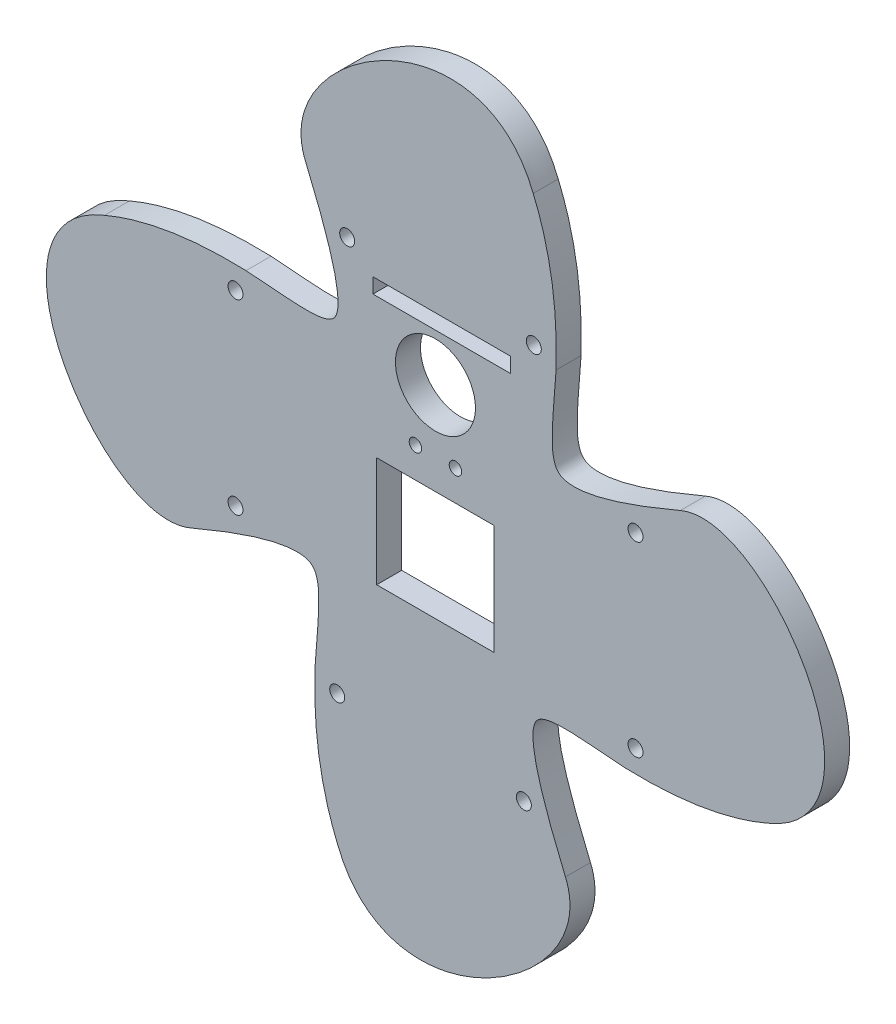
from build123d import *

# Parameters (mm, degrees)
SKETCH1_R           = 8
SKETCH1_R_2         = 1.25
SKETCH1_W           = 27.5
SKETCH1_H           = 3
SKETCH1_W_2         = 23.5
SKETCH1_H_2         = 22
BOSS_EXTRUDE1_DEPTH = 5
CUT_EXTRUDE1_REACH  = 168.202
SKETCH2_R           = 1.5


with BuildPart() as part:
    # Sketch1 → Boss-Extrude1 (new body)
    with BuildSketch(Plane.XY):
        with BuildLine():
            add(Edge.make_bspline(
                [(-3.541993631, -6.941220914), (-8.666968693, 5.104457964), (-8.115333257, 21.36652323)],
                knots=[0.001185094, 0.001185094, 0.001185094, 1.00088873, 1.00088873, 1.00088873], degree=2))
            add(Edge.make_bspline(
                [(-8.115333257, 21.36652323), (-8.080810315, 21.934786101), (-8.004120201, 23.085051659), (-7.838367146, 25.270998375), (-7.623235007, 27.854676625), (-7.414209946, 30.663838605), (-7.27340889, 33.980921817), (-7.462615956, 36.562976188), (-8.030022014, 38.161534692), (-8.552643779, 38.88333972), (-9.230781404, 39.372633244), (-10.414588865, 39.743554777), (-12.295748423, 39.832283225), (-14.89121535, 39.517347468), (-18.210216925, 38.741825063), (-21.599668946, 37.685342297), (-24.705628487, 36.582022017), (-27.236458553, 35.623490455), (-29.523814214, 34.710976102), (-31.451453068, 33.916688086), (-32.46952097, 33.488950312), (-32.970755281, 33.276491829)],
                knots=[6.7148e-05, 6.7148e-05, 6.7148e-05, 6.7148e-05, 0.031331216, 0.062595285, 0.125123423, 0.18765156, 0.250179698, 0.375235973, 0.437764111, 0.500292249, 0.562820386, 0.625348524, 0.687876661, 0.750404799, 0.812932937, 0.875461074, 0.906725143, 0.937989212, 0.969253281, 0.984885315, 1.00051735, 1.00051735, 1.00051735, 1.00051735], degree=3))
            add(Edge.make_bspline(
                [(-32.970755281, 33.276491829), (-33.543064712, 33.029267055), (-34.740218127, 32.630823037), (-37.170579589, 32.259967863), (-40.245026787, 32.517638811), (-43.829157608, 33.765614788), (-48.409124941, 36.43874912), (-53.65340763, 41.342650282), (-58.669628718, 48.874966672), (-61.24629117, 55.881625221), (-61.95764024, 61.562283019), (-61.693372768, 65.766463349), (-60.493626247, 69.792712762), (-58.610027435, 72.848927648), (-56.548030746, 75.0100654), (-54.72673098, 76.467485205), (-52.976799268, 77.533817668), (-51.446162247, 78.288793909), (-50.621789289, 78.638833511), (-50.210214326, 78.800731545)],
                knots=[0.000130926, 0.000130926, 0.000130926, 0.000130926, 0.031365398, 0.06259987, 0.125068815, 0.18753776, 0.250006704, 0.374944594, 0.499882483, 0.624820372, 0.687289317, 0.749758262, 0.812227207, 0.874696151, 0.905930624, 0.937165096, 0.968399568, 0.984016804, 0.999634041, 0.999634041, 0.999634041, 0.999634041], degree=3))
            add(Edge.make_bspline(
                [(-50.210214326, 78.800731545), (-38.164535448, 83.925706607), (-21.902470182, 83.374071171)],
                knots=[0.001185094, 0.001185094, 0.001185094, 1.00088873, 1.00088873, 1.00088873], degree=2))
            add(Edge.make_bspline(
                [(-21.902470182, 83.374071171), (-21.334207311, 83.339548229), (-20.183941753, 83.262858115), (-17.997995037, 83.09710506), (-15.414316787, 82.88197292), (-12.605154807, 82.67294786), (-9.288071595, 82.532146803), (-6.706017224, 82.721353869), (-5.10745872, 83.288759927), (-4.385653692, 83.811381693), (-3.896360168, 84.489519318), (-3.525438635, 85.673326779), (-3.436710187, 87.554486337), (-3.751645944, 90.149953264), (-4.527168349, 93.468954838), (-5.583651115, 96.858406859), (-6.686971395, 99.964366401), (-7.645502957, 102.495196467), (-8.55801731, 104.782552127), (-9.352305325, 106.710190982), (-9.7800431, 107.728258884), (-9.992501583, 108.229493195)],
                knots=[6.7148e-05, 6.7148e-05, 6.7148e-05, 6.7148e-05, 0.031331216, 0.062595285, 0.125123423, 0.18765156, 0.250179698, 0.375235973, 0.437764111, 0.500292249, 0.562820386, 0.625348524, 0.687876661, 0.750404799, 0.812932937, 0.875461074, 0.906725143, 0.937989212, 0.969253281, 0.984885315, 1.00051735, 1.00051735, 1.00051735, 1.00051735], degree=3))
            add(Edge.make_bspline(
                [(-9.992501583, 108.229493195), (-10.239726357, 108.801802626), (-10.638170375, 109.998956041), (-11.009025549, 112.429317503), (-10.751354601, 115.503764701), (-9.503378624, 119.087895522), (-6.830244292, 123.667862855), (-1.92634313, 128.912145544), (5.60597326, 133.928366631), (12.612631809, 136.505029084), (18.293289607, 137.216378153), (22.497469937, 136.952110682), (26.52371935, 135.752364161), (29.579934236, 133.868765349), (31.741071988, 131.806768659), (33.198491794, 129.985468894), (34.264824256, 128.235537182), (35.019800497, 126.704900161), (35.369840099, 125.880527203), (35.531738133, 125.468952239)],
                knots=[0.000130926, 0.000130926, 0.000130926, 0.000130926, 0.031365398, 0.06259987, 0.125068815, 0.18753776, 0.250006704, 0.374944594, 0.499882483, 0.624820372, 0.687289317, 0.749758262, 0.812227207, 0.874696151, 0.905930624, 0.937165096, 0.968399568, 0.984016804, 0.999634041, 0.999634041, 0.999634041, 0.999634041], degree=3))
            add(Edge.make_bspline(
                [(35.531738133, 125.468952239), (40.656713195, 113.423273362), (40.105077759, 97.161208095)],
                knots=[0.001185094, 0.001185094, 0.001185094, 1.00088873, 1.00088873, 1.00088873], degree=2))
            add(Edge.make_bspline(
                [(40.105077759, 97.161208095), (40.070554817, 96.592945225), (39.993864703, 95.442679666), (39.828111648, 93.256732951), (39.612979508, 90.6730547), (39.403954448, 87.863892721), (39.263153391, 84.546809509), (39.452360457, 81.964755138), (40.019766515, 80.366196634), (40.542388281, 79.644391606), (41.220525906, 79.155098082), (42.404333367, 78.784176549), (44.285492925, 78.695448101), (46.880959852, 79.010383858), (50.199961426, 79.785906263), (53.589413447, 80.842389028), (56.695372989, 81.945709309), (59.226203055, 82.90424087), (61.513558715, 83.816755223), (63.44119757, 84.611043239), (64.459265472, 85.038781014), (64.960499783, 85.251239496)],
                knots=[6.7148e-05, 6.7148e-05, 6.7148e-05, 6.7148e-05, 0.031331216, 0.062595285, 0.125123423, 0.18765156, 0.250179698, 0.375235973, 0.437764111, 0.500292249, 0.562820386, 0.625348524, 0.687876661, 0.750404799, 0.812932937, 0.875461074, 0.906725143, 0.937989212, 0.969253281, 0.984885315, 1.00051735, 1.00051735, 1.00051735, 1.00051735], degree=3))
            add(Edge.make_bspline(
                [(64.960499783, 85.251239496), (65.532809214, 85.49846427), (66.729962629, 85.896908288), (69.160324091, 86.267763462), (72.234771289, 86.010092514), (75.81890211, 84.762116538), (80.398869443, 82.088982206), (85.643152132, 77.185081044), (90.65937322, 69.652764653), (93.236035672, 62.646106105), (93.947384741, 56.965448307), (93.68311727, 52.761267977), (92.483370749, 48.735018564), (90.599771937, 45.678803677), (88.537775247, 43.517665925), (86.716475482, 42.06024612), (84.96654377, 40.993913657), (83.435906749, 40.238937417), (82.611533791, 39.888897814), (82.199958827, 39.726999781)],
                knots=[0.000130926, 0.000130926, 0.000130926, 0.000130926, 0.031365398, 0.06259987, 0.125068815, 0.18753776, 0.250006704, 0.374944594, 0.499882483, 0.624820372, 0.687289317, 0.749758262, 0.812227207, 0.874696151, 0.905930624, 0.937165096, 0.968399568, 0.984016804, 0.999634041, 0.999634041, 0.999634041, 0.999634041], degree=3))
            add(Edge.make_bspline(
                [(82.199958827, 39.726999781), (70.15427995, 34.602024719), (53.892214683, 35.153660155)],
                knots=[0.001185094, 0.001185094, 0.001185094, 1.00088873, 1.00088873, 1.00088873], degree=2))
            add(Edge.make_bspline(
                [(53.892214683, 35.153660155), (53.323951813, 35.188183097), (52.173686254, 35.26487321), (49.987739539, 35.430626266), (47.404061288, 35.645758405), (44.594899309, 35.854783466), (41.277816097, 35.995584522), (38.695761726, 35.806377456), (37.097203222, 35.238971398), (36.375398194, 34.716349633), (35.88610467, 34.038212008), (35.515183137, 32.854404547), (35.426454689, 30.973244989), (35.741390446, 28.377778061), (36.516912851, 25.058776487), (37.573395616, 21.669324466), (38.676715897, 18.563364925), (39.635247458, 16.032534859), (40.547761811, 13.745179198), (41.342049827, 11.817540344), (41.769787602, 10.799472441), (41.982246084, 10.298238131)],
                knots=[6.7148e-05, 6.7148e-05, 6.7148e-05, 6.7148e-05, 0.031331216, 0.062595285, 0.125123423, 0.18765156, 0.250179698, 0.375235973, 0.437764111, 0.500292249, 0.562820386, 0.625348524, 0.687876661, 0.750404799, 0.812932937, 0.875461074, 0.906725143, 0.937989212, 0.969253281, 0.984885315, 1.00051735, 1.00051735, 1.00051735, 1.00051735], degree=3))
            add(Edge.make_bspline(
                [(41.982246084, 10.298238131), (42.229470859, 9.7259287), (42.627914876, 8.528775285), (42.99877005, 6.098413823), (42.741099102, 3.023966625), (41.493123126, -0.560164196), (38.819988794, -5.140131529), (33.916087632, -10.384414218), (26.383771241, -15.400635306), (19.377112693, -17.977297758), (13.696454895, -18.688646828), (9.492274565, -18.424379356), (5.466025152, -17.224632835), (2.409810265, -15.341034023), (0.248672513, -13.279037334), (-1.208747292, -11.457737569), (-2.275079754, -9.707805856), (-3.030055995, -8.177168835), (-3.380095598, -7.352795877), (-3.541993631, -6.941220914)],
                knots=[0.000130926, 0.000130926, 0.000130926, 0.000130926, 0.031365398, 0.06259987, 0.125068815, 0.18753776, 0.250006704, 0.374944594, 0.499882483, 0.624820372, 0.687289317, 0.749758262, 0.812227207, 0.874696151, 0.905930624, 0.937165096, 0.968399568, 0.984016804, 0.999634041, 0.999634041, 0.999634041, 0.999634041], degree=3))
        make_face()
        with Locations((15.985900406, 82.503927946)):
            Circle(SKETCH1_R, mode=Mode.SUBTRACT)
        with Locations((11.985900406, 70.082072207)):
            Circle(SKETCH1_R_2, mode=Mode.SUBTRACT)
        with Locations(Location((19.985900406, 70.082072207, 0), (0, 0, 180))):
            Circle(SKETCH1_R_2, mode=Mode.SUBTRACT)
        with Locations((17.235900406, 93.503927946)):
            Rectangle(SKETCH1_W, SKETCH1_H, mode=Mode.SUBTRACT)
        with Locations((15.985900406, 53.032072207)):
            Rectangle(SKETCH1_W_2, SKETCH1_H_2, mode=Mode.SUBTRACT)
    extrude(amount=BOSS_EXTRUDE1_DEPTH)

    # Sketch2 → Cut-Extrude1 (cut, up to next)
    with BuildSketch(Plane.XY.offset(5), mode=Mode.PRIVATE) as cut_extrude1_sk1:
        with Locations((-1.671081209, 99.263865663)):
            Circle(SKETCH2_R)
    cut_extrude1_tool1 = extrude(cut_extrude1_sk1.sketch, amount=-CUT_EXTRUDE1_REACH, mode=Mode.PRIVATE) & part.part
    # Sketch2 → Cut-Extrude1 (cut, up to next)
    with BuildSketch(Plane.XY.offset(5), mode=Mode.PRIVATE) as cut_extrude1_sk2:
        with Locations((35.652879616, 99.263865663)):
            Circle(SKETCH2_R)
    cut_extrude1_tool2 = extrude(cut_extrude1_sk2.sketch, amount=-CUT_EXTRUDE1_REACH, mode=Mode.PRIVATE) & part.part
    # Sketch2 → Cut-Extrude1 (cut, up to next)
    with BuildSketch(Plane.XY.offset(5), mode=Mode.PRIVATE) as cut_extrude1_sk3:
        with Locations((55.994872251, 76.929819123)):
            Circle(SKETCH2_R)
    cut_extrude1_tool3 = extrude(cut_extrude1_sk3.sketch, amount=-CUT_EXTRUDE1_REACH, mode=Mode.PRIVATE) & part.part
    # Sketch2 → Cut-Extrude1 (cut, up to next)
    with BuildSketch(Plane.XY.offset(5), mode=Mode.PRIVATE) as cut_extrude1_sk4:
        with Locations((55.994872251, 39.605858298)):
            Circle(SKETCH2_R)
    cut_extrude1_tool4 = extrude(cut_extrude1_sk4.sketch, amount=-CUT_EXTRUDE1_REACH, mode=Mode.PRIVATE) & part.part
    # Sketch2 → Cut-Extrude1 (cut, up to next)
    with BuildSketch(Plane.XY.offset(5), mode=Mode.PRIVATE) as cut_extrude1_sk5:
        with Locations((33.660825711, 19.263865663)):
            Circle(SKETCH2_R)
    cut_extrude1_tool5 = extrude(cut_extrude1_sk5.sketch, amount=-CUT_EXTRUDE1_REACH, mode=Mode.PRIVATE) & part.part
    # Sketch2 → Cut-Extrude1 (cut, up to next)
    with BuildSketch(Plane.XY.offset(5), mode=Mode.PRIVATE) as cut_extrude1_sk6:
        with Locations((-3.663135114, 19.263865663)):
            Circle(SKETCH2_R)
    cut_extrude1_tool6 = extrude(cut_extrude1_sk6.sketch, amount=-CUT_EXTRUDE1_REACH, mode=Mode.PRIVATE) & part.part
    # Sketch2 → Cut-Extrude1 (cut, up to next)
    with BuildSketch(Plane.XY.offset(5), mode=Mode.PRIVATE) as cut_extrude1_sk7:
        with Locations((-24.005127749, 41.597912203)):
            Circle(SKETCH2_R)
    cut_extrude1_tool7 = extrude(cut_extrude1_sk7.sketch, amount=-CUT_EXTRUDE1_REACH, mode=Mode.PRIVATE) & part.part
    # Sketch2 → Cut-Extrude1 (cut, up to next)
    with BuildSketch(Plane.XY.offset(5), mode=Mode.PRIVATE) as cut_extrude1_sk8:
        with Locations((-24.005127749, 78.921873027)):
            Circle(SKETCH2_R)
    cut_extrude1_tool8 = extrude(cut_extrude1_sk8.sketch, amount=-CUT_EXTRUDE1_REACH, mode=Mode.PRIVATE) & part.part
    add(cut_extrude1_tool1.solids().sort_by_distance((-1.671081, 99.263866, 5))[0], mode=Mode.SUBTRACT)
    add(cut_extrude1_tool2.solids().sort_by_distance((35.65288, 99.263866, 5))[0], mode=Mode.SUBTRACT)
    add(cut_extrude1_tool3.solids().sort_by_distance((55.994872, 76.929819, 5))[0], mode=Mode.SUBTRACT)
    add(cut_extrude1_tool4.solids().sort_by_distance((55.994872, 39.605858, 5))[0], mode=Mode.SUBTRACT)
    add(cut_extrude1_tool5.solids().sort_by_distance((33.660826, 19.263866, 5))[0], mode=Mode.SUBTRACT)
    add(cut_extrude1_tool6.solids().sort_by_distance((-3.663135, 19.263866, 5))[0], mode=Mode.SUBTRACT)
    add(cut_extrude1_tool7.solids().sort_by_distance((-24.005128, 41.597912, 5))[0], mode=Mode.SUBTRACT)
    add(cut_extrude1_tool8.solids().sort_by_distance((-24.005128, 78.921873, 5))[0], mode=Mode.SUBTRACT)


solid = part.part
